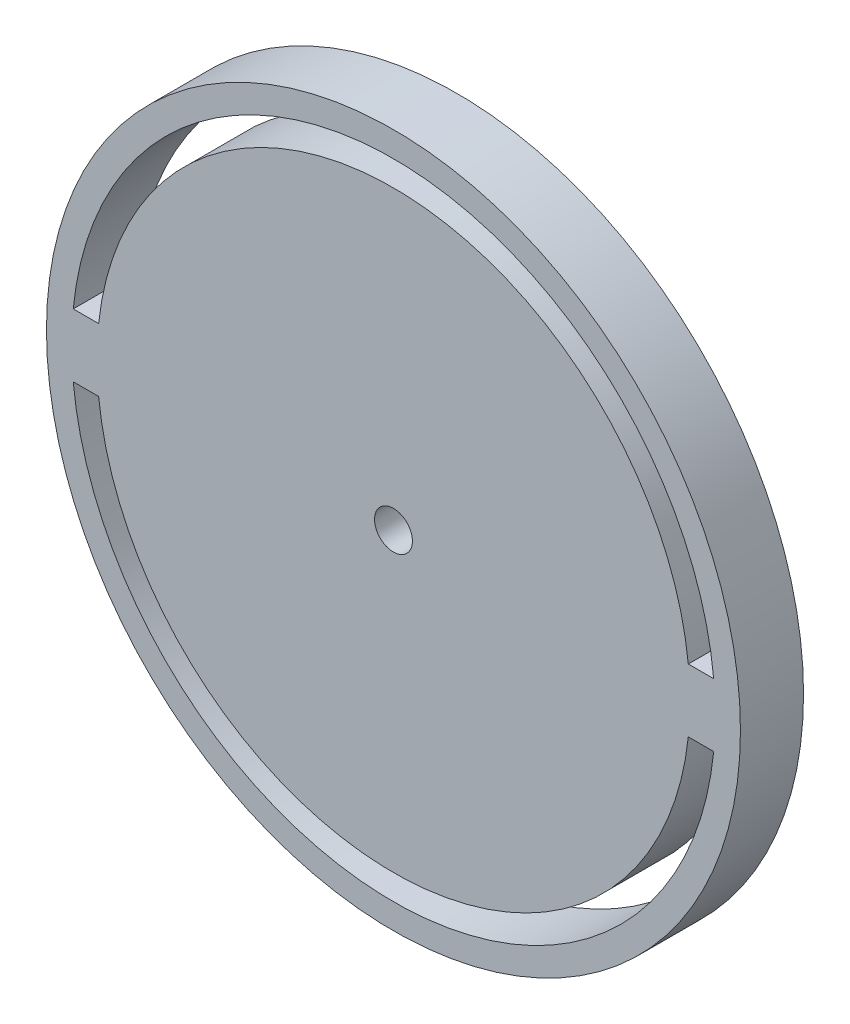
from build123d import *

# Parameters (mm, degrees)
SKETCH1_R           = 55
SKETCH1_R_2         = 3
BOSS_EXTRUDE1_DEPTH = 10
CUT_EXTRUDE1_DEPTH  = 10


with BuildPart() as part:
    # Sketch1 → Boss-Extrude1 (new body)
    with BuildSketch(Plane.XY):
        Circle(SKETCH1_R)
        Circle(SKETCH1_R_2, mode=Mode.SUBTRACT)
    extrude(amount=BOSS_EXTRUDE1_DEPTH)

    # Sketch2 → Cut-Extrude1 (cut)
    with BuildSketch(Plane.XY.offset(10)):
        with BuildLine():
            Line((-50.754310162, -5), (-46.733285782, -5))
            ThreePointArc((-46.733285782, -5), (0, -47), (46.733285782, -5))
            Line((46.733285782, -5), (50.754310162, -5))
            ThreePointArc((50.754310162, -5), (0, -51), (-50.754310162, -5))
        make_face()
        with BuildLine():
            Line((-50.754310162, 5), (-46.733285782, 5))
            ThreePointArc((-46.733285782, 5), (0, 47), (46.733285782, 5))
            Line((46.733285782, 5), (50.754310162, 5))
            ThreePointArc((50.754310162, 5), (0, 51), (-50.754310162, 5))
        make_face()
    extrude(amount=-CUT_EXTRUDE1_DEPTH, mode=Mode.SUBTRACT)


solid = part.part
